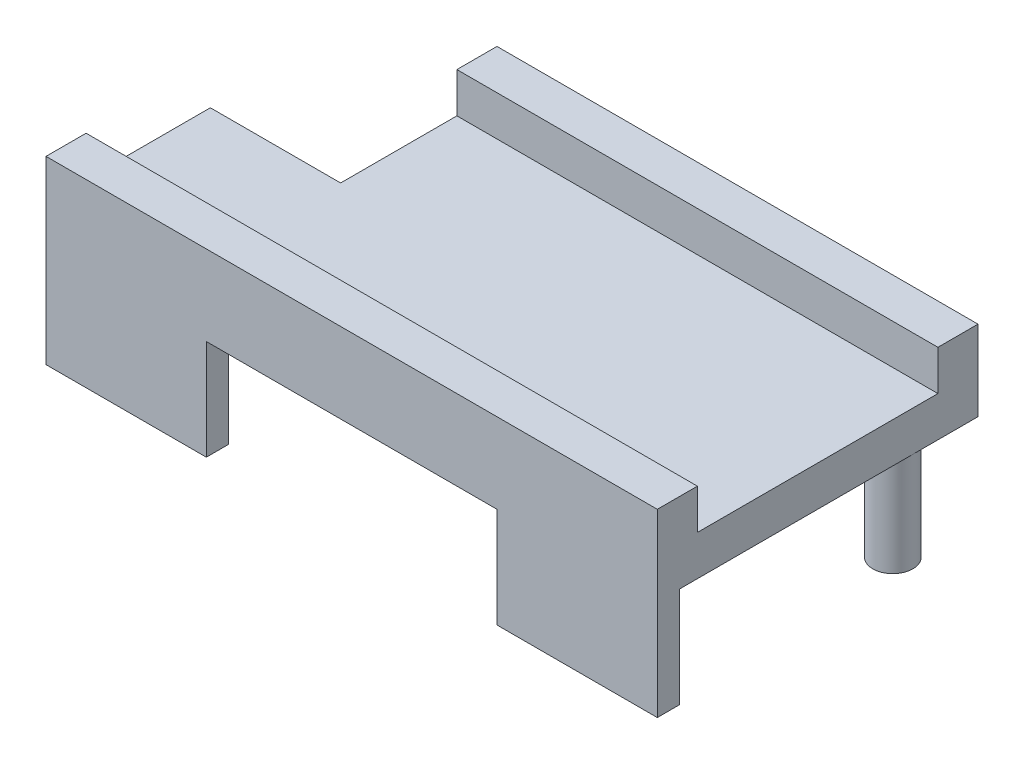
from build123d import *

# Parameters (mm, degrees)
SKETCH1_W           = 30.5
SKETCH1_H           = 16
BOSS_EXTRUDE1_DEPTH = 2
SKETCH3_R           = 1
SKETCH3_W           = 2.9
SKETCH3_H           = 2.8
SKETCH3_W_2         = 8
SKETCH3_H_2         = 1.1
BOSS_EXTRUDE3_DEPTH = 8
CUT_EXTRUDE2_DEPTH  = 10
CUT_EXTRUDE3_START  = -3
SKETCH5_R           = 1
SKETCH5_W           = 30.5
SKETCH5_H           = 1.1
CUT_EXTRUDE3_DEPTH  = 3
SKETCH6_W           = 30.5
SKETCH6_H           = 2
SKETCH6_W_2         = 24
BOSS_EXTRUDE4_DEPTH = 2


with BuildPart() as part:
    # Sketch1 → Boss-Extrude1 (new body)
    with BuildSketch(Plane(origin=(0, 0, 0), x_dir=(1, 0, 0), z_dir=(0, 1, 0))):
        Rectangle(SKETCH1_W, SKETCH1_H)
    extrude(amount=BOSS_EXTRUDE1_DEPTH)

    # Sketch3 → Boss-Extrude3 (add)
    with BuildSketch(Plane(origin=(0, 0, 0), x_dir=(1, 0, 0), z_dir=(0, 1, 0))):
        with Locations(Location((14.2, 4.8, 0), (0, 0, 270))):
            Circle(SKETCH3_R)
        with Locations((-4.25, 6.6)):
            Rectangle(SKETCH3_W, SKETCH3_H)
        with Locations((-11.25, -7.45)):
            Rectangle(SKETCH3_W_2, SKETCH3_H_2)
        with Locations((11.25, -7.45)):
            Rectangle(SKETCH3_W_2, SKETCH3_H_2)
    extrude(amount=-BOSS_EXTRUDE3_DEPTH)

    # Sketch4 → Cut-Extrude2 (cut)
    with BuildSketch(Plane(origin=(0, 0, 0), x_dir=(1, 0, 0), z_dir=(0, 1, 0))):
        Polygon((-15.25, 2.7), (-15.25, 8), (-8.75, 8), (-8.75, 2.7), (-8.75, 0.2), (-15.25, 0.2), align=None)
    extrude(amount=CUT_EXTRUDE2_DEPTH, mode=Mode.SUBTRACT)

    # Sketch5 → Cut-Extrude3 (cut)
    with BuildSketch(Plane.XZ.offset(8).offset(CUT_EXTRUDE3_START)):
        with Locations(Location((14.2, -4.8, 0), (0, 0, 90))):
            Circle(SKETCH5_R)
        with Locations((0, 7.45)):
            Rectangle(SKETCH5_W, SKETCH5_H)
    extrude(amount=CUT_EXTRUDE3_DEPTH, mode=Mode.SUBTRACT)

    # Sketch6 → Boss-Extrude4 (add)
    with BuildSketch(Plane(origin=(0, 2, 0), x_dir=(1, 0, 0), z_dir=(0, 1, 0))):
        with Locations((0, -7)):
            Rectangle(SKETCH6_W, SKETCH6_H)
        with Locations((3.25, 7)):
            Rectangle(SKETCH6_W_2, SKETCH6_H)
    extrude(amount=BOSS_EXTRUDE4_DEPTH)


solid = part.part
